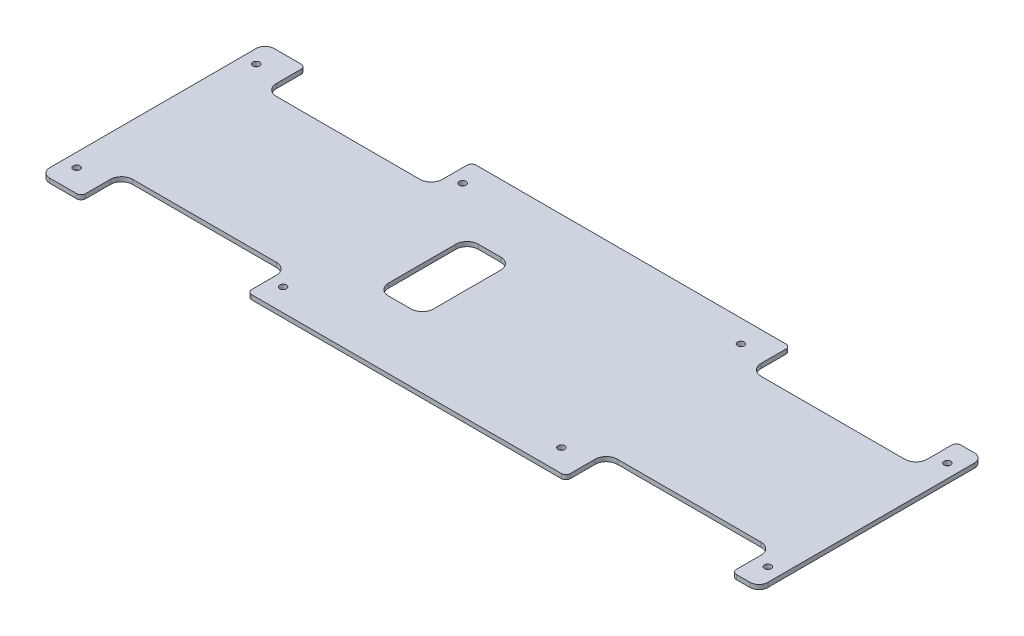
from build123d import *

# Parameters (mm, degrees)
SKETCH_1_R      = 1.5
SKETCH_1_W      = 20
SKETCH_1_H      = 40
EXTRUDE_1_DEPTH = 2
FILLET_1_R      = 4
FILLET_2_R      = 2
FILLET_3_R      = 5


with BuildPart() as part:
    # 草图1 → 凸台-拉伸1 (new body)
    with BuildSketch(Plane(origin=(0, 0, 0), x_dir=(1, 0, 0), z_dir=(0, 1, 0))):
        Polygon((0, -50), (0, 50), (18, 50), (18, 32), (92, 32), (92, 50), (234, 50), (234, 32), (308, 32), (308, 50), (320, 50), (320, -50), (308, -50), (308, -32), (234, -32), (234, -50), (92, -50), (92, -32), (18, -32), (18, -50), align=None)
        with Locations(Location((6, 40, 0), (0, 0, 270))):
            Circle(SKETCH_1_R, mode=Mode.SUBTRACT)
        with Locations(Location((98, 40, 0), (0, 0, 270))):
            Circle(SKETCH_1_R, mode=Mode.SUBTRACT)
        with Locations(Location((222, 40, 0), (0, 0, 270))):
            Circle(SKETCH_1_R, mode=Mode.SUBTRACT)
        with Locations(Location((314, 40, 0), (0, 0, 270))):
            Circle(SKETCH_1_R, mode=Mode.SUBTRACT)
        with Locations(Location((314, -40, 0), (0, 0, 90))):
            Circle(SKETCH_1_R, mode=Mode.SUBTRACT)
        with Locations(Location((222, -40, 0), (0, 0, 90))):
            Circle(SKETCH_1_R, mode=Mode.SUBTRACT)
        with Locations(Location((98, -40, 0), (0, 0, 90))):
            Circle(SKETCH_1_R, mode=Mode.SUBTRACT)
        with Locations(Location((6, -40, 0), (0, 0, 90))):
            Circle(SKETCH_1_R, mode=Mode.SUBTRACT)
        with Locations((130, 0)):
            Rectangle(SKETCH_1_W, SKETCH_1_H, mode=Mode.SUBTRACT)
    extrude(amount=EXTRUDE_1_DEPTH)

    # 圆角1
    fillet_1_edges = [part.edges().sort_by_distance(p)[0] for p in [
        (320, 1, -50),
        (320, 1, 50),
        (0, 1, 50),
        (0, 1, -50),
    ]]
    fillet(fillet_1_edges, radius=FILLET_1_R)

    # 圆角2
    fillet_2_edges = [part.edges().sort_by_distance(p)[0] for p in [
        (92, 1, -50),
        (234, 1, -50),
        (308, 1, -50),
        (308, 1, 50),
        (234, 1, 50),
        (92, 1, 50),
        (18, 1, 50),
        (18, 1, -50),
    ]]
    fillet(fillet_2_edges, radius=FILLET_2_R)

    # 圆角3
    fillet_3_edges = [part.edges().sort_by_distance(p)[0] for p in [
        (18, 1, -32),
        (92, 1, -32),
        (234, 1, -32),
        (308, 1, -32),
        (308, 1, 32),
        (234, 1, 32),
        (92, 1, 32),
        (18, 1, 32),
        (140, 1, 20),
        (140, 1, -20),
        (120, 1, -20),
        (120, 1, 20),
    ]]
    fillet(fillet_3_edges, radius=FILLET_3_R)


solid = part.part
